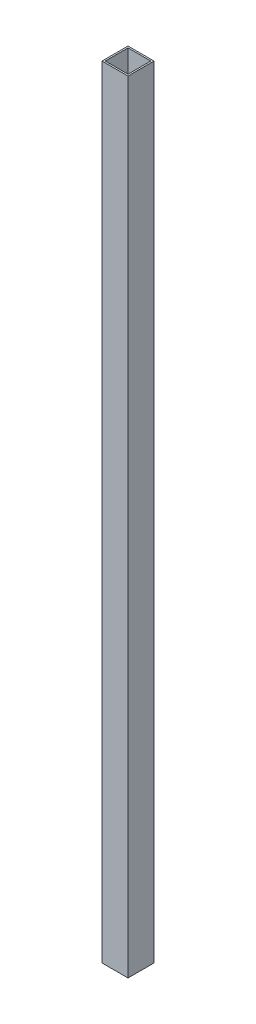
from build123d import *

# Parameters (mm, degrees)
SKETCH1_W           = 25.4
SKETCH1_H           = 25.4
SKETCH1_W_2         = 22.225
SKETCH1_H_2         = 22.225
BOSS_EXTRUDE1_DEPTH = 762


with BuildPart() as part:
    # Sketch1 → Boss-Extrude1 (new body)
    with BuildSketch(Plane(origin=(0, 0, 0), x_dir=(1, 0, 0), z_dir=(0, 1, 0))):
        with Locations((12.7, 12.7)):
            Rectangle(SKETCH1_W, SKETCH1_H)
        with Locations((12.7, 12.7)):
            Rectangle(SKETCH1_W_2, SKETCH1_H_2, mode=Mode.SUBTRACT)
    extrude(amount=BOSS_EXTRUDE1_DEPTH)


solid = part.part
